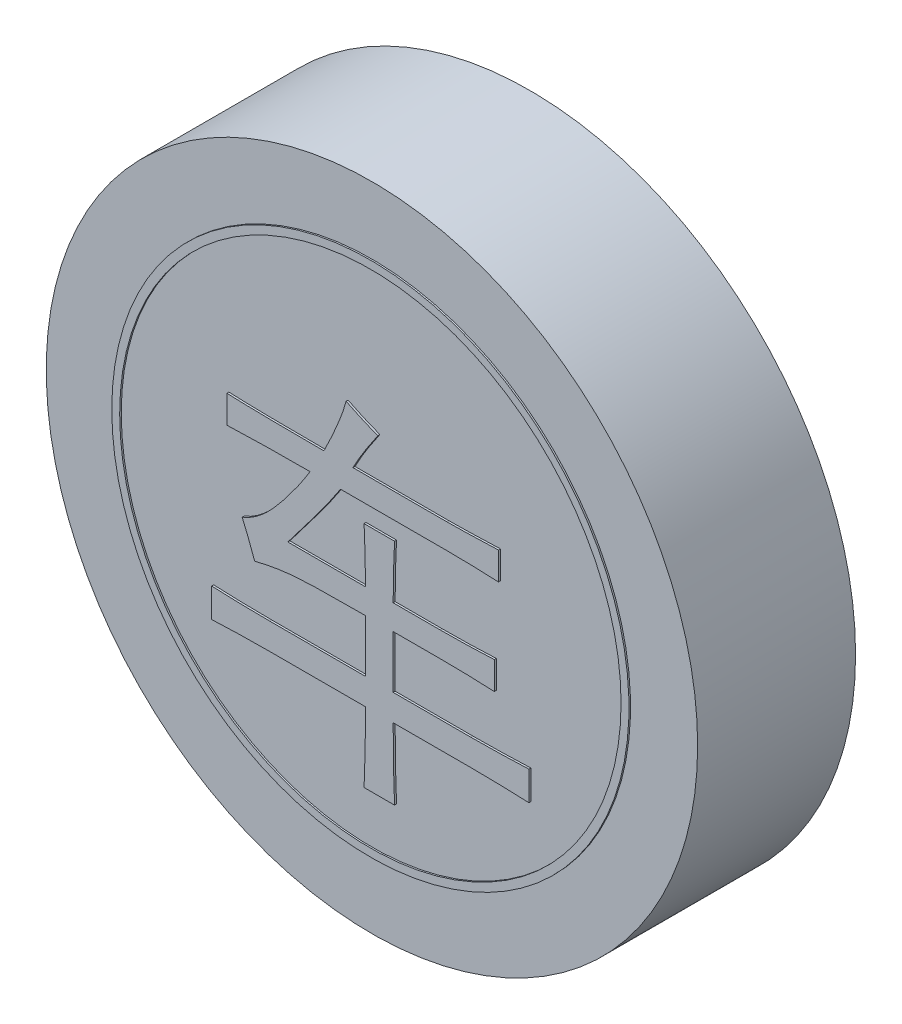
from build123d import *

# Parameters (mm, degrees)
SKETCH_1_R               = 16.5
DIAMETER33_HEIGHT8_DEPTH = 8
CHARACTER_DEPTH          = 0.1
SKETCH_3_R               = 13.1
SKETCH_3_R_2             = 12.7
INK_RING_DEPTH           = 0.08


with BuildPart() as part:
    # 草图1 → Diameter33_Height8 (new body)
    with BuildSketch(Plane.XY):
        Circle(SKETCH_1_R)
    extrude(amount=-DIAMETER33_HEIGHT8_DEPTH)

    # 草图2 → Character_车 (add)
    with BuildSketch(Plane.XY):
        with BuildLine():
            add(Edge.make_bspline(
                [(-5.842105263, -3.026315789), (-5.898820329, -2.869331425), (-6.006873714, -2.570245254), (-6.168804206, -2.144780878), (-6.320461844, -1.762772614), (-6.42455933, -1.524652502), (-6.473684211, -1.412280702)],
                knots=[0, 0, 0, 0, 1.155372541, 2.201212519, 3.151130129, 4, 4, 4, 4], degree=3))
            add(Edge.make_bspline(
                [(-6.473684211, -1.412280702), (-6.396823444, -1.379800087), (-6.239919961, -1.313494196), (-6.010146568, -1.186156652), (-5.778564765, -1.035723149), (-5.547823353, -0.856912408), (-5.313044861, -0.657208498), (-5.079209262, -0.430138074), (-4.845963085, -0.176973346), (-4.534501394, 0.18732381), (-4.164145867, 0.656391458), (-3.748633816, 1.216101595), (-3.371664409, 1.762234908), (-3.145394749, 2.128474715), (-3.035087719, 2.307017544)],
                knots=[0, 0, 0, 0, 0.584208733, 1.192603045, 1.837360117, 2.517159342, 3.236043131, 3.995784846, 4.79889664, 5.646810753, 7.353001509, 8.984483524, 10.529928116, 12, 12, 12, 12], degree=3))
            add(Edge.make_bspline(
                [(-3.035087719, 2.307017544), (-3.246482619, 2.307526273), (-3.658883418, 2.308518731), (-4.261856974, 2.301476847), (-4.833674599, 2.297370313), (-5.375169247, 2.289752816), (-5.886281193, 2.27816959), (-6.367224064, 2.269967872), (-6.816777836, 2.252736276), (-7.106129451, 2.242011892), (-7.245614035, 2.236842105)],
                knots=[0, 0, 0, 0, 1.204686206, 2.35016811, 3.436405474, 4.463457902, 5.436294372, 6.34989698, 7.204552796, 8, 8, 8, 8], degree=3))
            Line((-7.245614035, 2.236842105), (-7.245614035, 3.640350877))
            add(Edge.make_bspline(
                [(-7.245614035, 3.640350877), (-7.112197092, 3.635099441), (-6.825465539, 3.623813374), (-6.364629063, 3.606862837), (-5.842966328, 3.598841349), (-5.259942843, 3.587169275), (-4.61534822, 3.57975231), (-3.909248078, 3.575626696), (-3.141661522, 3.568632873), (-2.609705057, 3.569648027), (-2.333333333, 3.570175439)],
                knots=[0, 0, 0, 0, 0.652233806, 1.401741091, 2.25255631, 3.200691931, 4.250322975, 5.401478114, 6.649968519, 8, 8, 8, 8], degree=3))
            add(Edge.make_bspline(
                [(-2.333333333, 3.570175439), (-2.265182445, 3.706781651), (-2.13249513, 3.972749008), (-1.948730322, 4.364802108), (-1.781805751, 4.736299128), (-1.633474827, 5.088418502), (-1.500571846, 5.419860952), (-1.385562669, 5.732537711), (-1.288604233, 6.025373857), (-1.235803724, 6.215836544), (-1.210526316, 6.307017544)],
                knots=[0, 0, 0, 0, 1.236548776, 2.407515765, 3.506966959, 4.535340541, 5.502281012, 6.399229081, 7.23365623, 8, 8, 8, 8], degree=3))
            add(Edge.make_bspline(
                [(-1.210526316, 6.307017544), (-1.072464078, 6.238250423), (-0.801072324, 6.103073492), (-0.390506761, 5.92371698), (0.006858558, 5.752049753), (0.273104458, 5.653521307), (0.403508772, 5.605263158)],
                knots=[0, 0, 0, 0, 1.050893361, 2.065762486, 3.052631741, 4, 4, 4, 4], degree=3))
            add(Edge.make_bspline(
                [(0.403508772, 5.605263158), (0.287716291, 5.440743002), (0.057094455, 5.113071117), (-0.262779106, 4.605286149), (-0.575699306, 4.095748706), (-0.765073243, 3.745229449), (-0.859649123, 3.570175439)],
                knots=[0, 0, 0, 0, 1.007065107, 2.005753766, 3.00404673, 4, 4, 4, 4], degree=3))
            Line((-0.859649123, 3.570175439), (3.912280702, 3.570175439))
            add(Edge.make_bspline(
                [(3.912280702, 3.570175439), (3.986792128, 3.569779735), (4.146229603, 3.568933021), (4.399164705, 3.576215116), (4.681635542, 3.580205028), (4.991801347, 3.588183635), (5.330489118, 3.599673551), (5.697948203, 3.608156571), (6.093748619, 3.625727153), (6.367546823, 3.635374682), (6.50877193, 3.640350877)],
                knots=[0, 0, 0, 0, 0.688397439, 1.473013676, 2.337661006, 3.298515698, 4.339608953, 5.468714639, 6.694363069, 8, 8, 8, 8], degree=3))
            Line((6.50877193, 3.640350877), (6.50877193, 2.236842105))
            add(Edge.make_bspline(
                [(6.50877193, 2.236842105), (6.279214943, 2.247975922), (5.82888106, 2.269817709), (5.1668562, 2.289395513), (4.530922728, 2.303382911), (4.115883288, 2.305821342), (3.912280702, 2.307017544)],
                knots=[0, 0, 0, 0, 1.061662981, 2.082719505, 3.05945501, 4, 4, 4, 4], degree=3))
            Line((3.912280702, 2.307017544), (-1.49122807, 2.307017544))
            add(Edge.make_bspline(
                [(-1.49122807, 2.307017544), (-1.56117399, 2.201167925), (-1.710872673, 1.974627926), (-1.95506101, 1.616085811), (-2.235185889, 1.218787258), (-2.555254083, 0.784910796), (-2.903437302, 0.30729052), (-3.289360757, -0.207943656), (-3.711097719, -0.76191269), (-4.005224498, -1.143853854), (-4.157894737, -1.342105263)],
                knots=[0, 0, 0, 0, 0.673545103, 1.441525336, 2.302896076, 3.254132591, 4.303779702, 5.440759354, 6.671593656, 8, 8, 8, 8], degree=3))
            Line((-4.157894737, -1.342105263), (-0.228070175, -1.342105263))
            add(Edge.make_bspline(
                [(-0.228070175, -1.342105263), (-0.231461537, -0.891528138), (-0.238331174, 0.021173694), (-0.278106388, 0.933036802), (-0.298245614, 1.394736842)],
                knots=[0, 0, 0, 0, 0.987347913, 2, 2, 2, 2], degree=3))
            Line((-0.298245614, 1.394736842), (1.245614035, 1.394736842))
            add(Edge.make_bspline(
                [(1.245614035, 1.394736842), (1.234342441, 1.188579897), (1.211003525, 0.761712205), (1.192285381, 0.099612341), (1.178632375, -0.606505386), (1.176525709, -1.091718406), (1.175438596, -1.342105263)],
                knots=[0, 0, 0, 0, 0.904818853, 1.873514066, 2.902659025, 4, 4, 4, 4], degree=3))
            Line((1.175438596, -1.342105263), (3.561403509, -1.342105263))
            add(Edge.make_bspline(
                [(3.561403509, -1.342105263), (4.023251472, -1.338996907), (4.935977079, -1.332854028), (5.847809296, -1.292074512), (6.298245614, -1.271929825)],
                knots=[0, 0, 0, 0, 1.012019295, 2, 2, 2, 2], degree=3))
            Line((6.298245614, -1.271929825), (6.298245614, -2.675438596))
            add(Edge.make_bspline(
                [(6.298245614, -2.675438596), (5.847809296, -2.655293909), (4.935977079, -2.614514393), (4.023251472, -2.608371514), (3.561403509, -2.605263158)],
                knots=[0, 0, 0, 0, 0.987980705, 2, 2, 2, 2], degree=3))
            Line((3.561403509, -2.605263158), (1.175438596, -2.605263158))
            Line((1.175438596, -2.605263158), (1.175438596, -5.271929825))
            Line((1.175438596, -5.271929825), (5.105263158, -5.271929825))
            add(Edge.make_bspline(
                [(5.105263158, -5.271929825), (5.333122844, -5.270715306), (5.801003783, -5.268221447), (6.520106526, -5.254311899), (7.274811493, -5.234595053), (7.789282241, -5.212873368), (8.052631579, -5.201754386)],
                knots=[0, 0, 0, 0, 0.927389459, 1.904276523, 2.92723271, 4, 4, 4, 4], degree=3))
            Line((8.052631579, -5.201754386), (8.052631579, -6.675438596))
            add(Edge.make_bspline(
                [(8.052631579, -6.675438596), (7.789282241, -6.664319614), (7.274811493, -6.64259793), (6.520106526, -6.622881083), (5.801003783, -6.608971535), (5.333122844, -6.606477676), (5.105263158, -6.605263158)],
                knots=[0, 0, 0, 0, 1.07276729, 2.095723477, 3.072610541, 4, 4, 4, 4], degree=3))
            Line((5.105263158, -6.605263158), (1.175438596, -6.605263158))
            add(Edge.make_bspline(
                [(1.175438596, -6.605263158), (1.17492319, -6.788068469), (1.173921664, -7.143291287), (1.180988322, -7.662224869), (1.185055025, -8.151741366), (1.192680502, -8.613534144), (1.204276819, -9.04666503), (1.212388046, -9.451393023), (1.229724118, -9.827285169), (1.240445713, -10.06811771), (1.245614035, -10.184210526)],
                knots=[0, 0, 0, 0, 1.225493371, 2.381348807, 3.479127077, 4.507295234, 5.477513674, 6.383863443, 7.220944797, 8, 8, 8, 8], degree=3))
            Line((1.245614035, -10.184210526), (-0.298245614, -10.184210526))
            add(Edge.make_bspline(
                [(-0.298245614, -10.184210526), (-0.293088467, -10.062919018), (-0.28244323, -9.812552555), (-0.26517016, -9.425394066), (-0.256955584, -9.014609066), (-0.245308677, -8.579745809), (-0.237743343, -8.120551737), (-0.233625145, -7.637100266), (-0.226569426, -7.129429714), (-0.227561666, -6.782870303), (-0.228070175, -6.605263158)],
                knots=[0, 0, 0, 0, 0.813876, 1.679979569, 2.597948426, 3.568174058, 4.596349836, 5.676713029, 6.809345956, 8, 8, 8, 8], degree=3))
            Line((-0.228070175, -6.605263158), (-5.070175439, -6.605263158))
            add(Edge.make_bspline(
                [(-5.070175439, -6.605263158), (-5.324893201, -6.606388994), (-5.827429759, -6.608610173), (-6.573394245, -6.622429105), (-7.301292576, -6.641441143), (-7.781058, -6.664213602), (-8.01754386, -6.675438596)],
                knots=[0, 0, 0, 0, 1.036669794, 2.04526165, 3.036470834, 4, 4, 4, 4], degree=3))
            Line((-8.01754386, -6.675438596), (-8.01754386, -5.201754386))
            add(Edge.make_bspline(
                [(-8.01754386, -5.201754386), (-7.781058, -5.212979381), (-7.301292576, -5.235751839), (-6.573394245, -5.254763877), (-5.827429759, -5.268582809), (-5.324893201, -5.270803988), (-5.070175439, -5.271929825)],
                knots=[0, 0, 0, 0, 0.963529166, 1.95473835, 2.963330206, 4, 4, 4, 4], degree=3))
            Line((-5.070175439, -5.271929825), (-0.228070175, -5.271929825))
            Line((-0.228070175, -5.271929825), (-0.228070175, -2.605263158))
            add(Edge.make_bspline(
                [(-0.228070175, -2.605263158), (-0.430801667, -2.604732204), (-0.819811605, -2.603713387), (-1.378600845, -2.610674903), (-1.888907343, -2.614839935), (-2.351576194, -2.622216615), (-2.76650508, -2.633903903), (-3.133156573, -2.641670696), (-3.450969213, -2.659258343), (-3.813777921, -2.677582124), (-4.243119388, -2.723022723), (-4.761241386, -2.794248367), (-5.296964879, -2.896480162), (-5.65789017, -2.982441435), (-5.842105263, -3.026315789)],
                knots=[0, 0, 0, 0, 1.292465027, 2.480037691, 3.562671594, 4.545968376, 5.429981271, 6.209087619, 6.883751335, 7.459135407, 8.52479941, 9.634773871, 10.792796285, 12, 12, 12, 12], degree=3))
        make_face()
    extrude(amount=CHARACTER_DEPTH)

    # 草图3 → Ink_ring (add)
    with BuildSketch(Plane.XY):
        with Locations(Location((0, 0, 0), (0, 0, 180))):
            Circle(SKETCH_3_R)
        with Locations(Location((0, 0, 0), (0, 0, 180))):
            Circle(SKETCH_3_R_2, mode=Mode.SUBTRACT)
    extrude(amount=INK_RING_DEPTH)


solid = part.part
